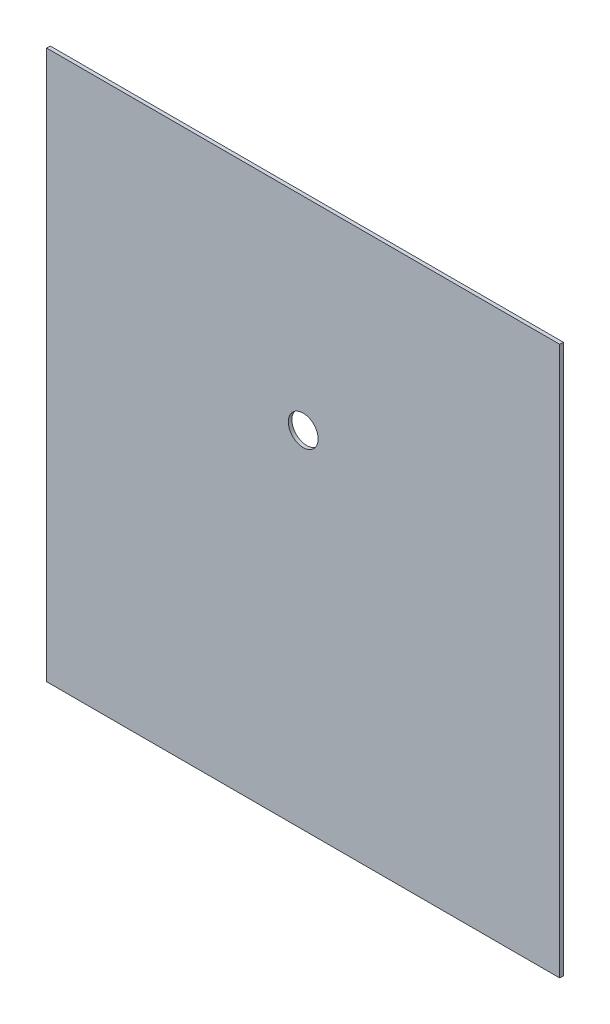
from build123d import *

# Parameters (mm, degrees)
SKETCH1_W           = 430
SKETCH1_H           = 460
SKETCH1_R           = 12.5
BOSS_EXTRUDE1_DEPTH = 3


with BuildPart() as part:
    # Sketch1 → Boss-Extrude1 (new body)
    with BuildSketch(Plane.XY):
        Rectangle(SKETCH1_W, SKETCH1_H)
        with Locations((0, 60)):
            Circle(SKETCH1_R, mode=Mode.SUBTRACT)
    extrude(amount=BOSS_EXTRUDE1_DEPTH)


solid = part.part
